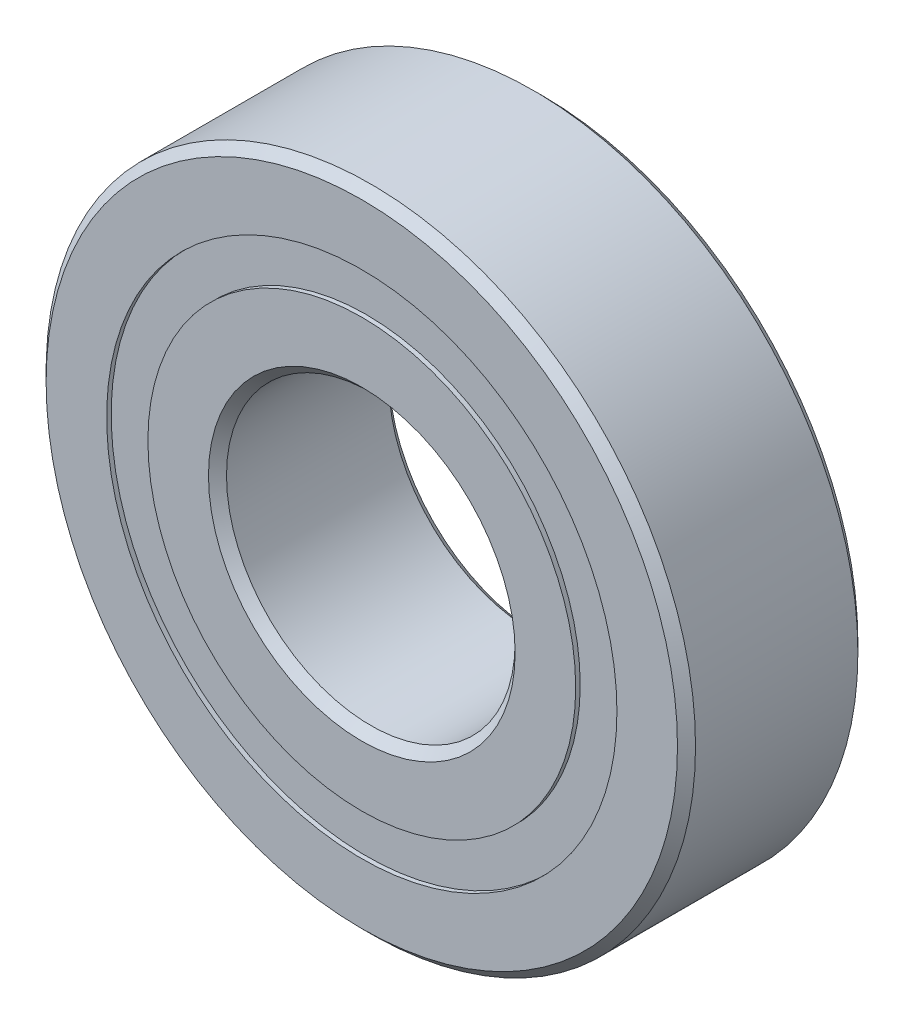
from build123d import *

# Parameters (mm, degrees)
CIRPATTERN1_COUNT = 10
SKETCH5_W         = 1.786827644
SKETCH5_H         = 1.814285714


with BuildPart() as part:
    # Sketch1 → Revolve1 (revolve)
    with BuildSketch(Plane(origin=(0, 0, 0), x_dir=(0, 0, -1), z_dir=(1, 0, 0))):
        with BuildLine():
            Line((3.571875, 14.2875), (-3.571875, 14.2875))
            Line((-3.571875, 14.2875), (-3.96875, 13.890625))
            Line((-3.96875, 13.890625), (-3.96875, 11.225892857))
            Line((-3.96875, 11.225892857), (-1.763888889, 11.225892857))
            ThreePointArc((-1.763888889, 11.225892857), (0, 12.302234856), (1.763888889, 11.225892857))
            Line((1.763888889, 11.225892857), (3.96875, 11.225892857))
            Line((3.96875, 11.225892857), (3.96875, 13.890625))
            Line((3.96875, 13.890625), (3.571875, 14.2875))
        make_face()
    revolve(axis=Axis((0, 0, 3.96875), (0, 0, -1)))


with BuildPart() as body_2:
    # Sketch3 → Revolve3 (revolve)
    with BuildSketch(Plane(origin=(0, 0, 0), x_dir=(0, 0, -1), z_dir=(1, 0, 0))):
        with BuildLine():
            Line((-3.96875, 9.411607143), (-1.763888889, 9.411607143))
            ThreePointArc((-1.763888889, 9.411607143), (0, 8.335265144), (1.763888889, 9.411607143))
            Line((1.763888889, 9.411607143), (3.96875, 9.411607143))
            Line((3.96875, 9.411607143), (3.96875, 6.746875))
            Line((3.96875, 6.746875), (3.571875, 6.35))
            Line((3.571875, 6.35), (-3.571875, 6.35))
            Line((-3.571875, 6.35), (-3.96875, 6.746875))
            Line((-3.96875, 6.746875), (-3.96875, 9.411607143))
        make_face()
    revolve(axis=Axis((0, 0, 3.96875), (0, 0, -1)))


with BuildPart() as body_3:
    # Sketch4 → Revolve4 (revolve)
    with BuildSketch(Plane(origin=(0, 0, 0), x_dir=(0, 0, -1), z_dir=(1, 0, 0))):
        with BuildLine():
            Line((-1.983484856, 10.31875), (1.983484856, 10.31875))
            ThreePointArc((1.983484856, 10.31875), (0, 12.302234856), (-1.983484856, 10.31875))
        make_face()
    revolve(axis=Axis((0, 10.31875, 1.983484856), (0, 0, -1)))


with BuildPart() as cirpattern1_1:
    # CirPattern1: pattern copy
    add(body_3.part.rotate(Axis((0, 0, -3.96875), (0, 0, 1)), 1 * 360 / CIRPATTERN1_COUNT))


with BuildPart() as cirpattern1_2:
    # CirPattern1: pattern copy
    add(body_3.part.rotate(Axis((0, 0, -3.96875), (0, 0, 1)), 2 * 360 / CIRPATTERN1_COUNT))


with BuildPart() as cirpattern1_3:
    # CirPattern1: pattern copy
    add(body_3.part.rotate(Axis((0, 0, -3.96875), (0, 0, 1)), 3 * 360 / CIRPATTERN1_COUNT))


with BuildPart() as cirpattern1_4:
    # CirPattern1: pattern copy
    add(body_3.part.rotate(Axis((0, 0, -3.96875), (0, 0, 1)), 4 * 360 / CIRPATTERN1_COUNT))


with BuildPart() as cirpattern1_5:
    # CirPattern1: pattern copy
    add(body_3.part.rotate(Axis((0, 0, -3.96875), (0, 0, 1)), 5 * 360 / CIRPATTERN1_COUNT))


with BuildPart() as cirpattern1_6:
    # CirPattern1: pattern copy
    add(body_3.part.rotate(Axis((0, 0, -3.96875), (0, 0, 1)), 6 * 360 / CIRPATTERN1_COUNT))


with BuildPart() as cirpattern1_7:
    # CirPattern1: pattern copy
    add(body_3.part.rotate(Axis((0, 0, -3.96875), (0, 0, 1)), 7 * 360 / CIRPATTERN1_COUNT))


with BuildPart() as cirpattern1_8:
    # CirPattern1: pattern copy
    add(body_3.part.rotate(Axis((0, 0, -3.96875), (0, 0, 1)), 8 * 360 / CIRPATTERN1_COUNT))


with BuildPart() as cirpattern1_9:
    # CirPattern1: pattern copy
    add(body_3.part.rotate(Axis((0, 0, -3.96875), (0, 0, 1)), 9 * 360 / CIRPATTERN1_COUNT))


with BuildPart() as body_13:
    # Sketch5 → Revolve5 (revolve)
    with BuildSketch(Plane(origin=(0, 0, 0), x_dir=(0, 0, -1), z_dir=(1, 0, 0))):
        with Locations((-2.876898678, 10.31875)):
            Rectangle(SKETCH5_W, SKETCH5_H)
        with Locations((2.876898678, 10.31875)):
            Rectangle(SKETCH5_W, SKETCH5_H)
    revolve(axis=Axis((0, 0, 3.96875), (0, 0, -1)))


solid = Compound([part.part, body_2.part, body_3.part, cirpattern1_1.part, cirpattern1_2.part, cirpattern1_3.part, cirpattern1_4.part, cirpattern1_5.part, cirpattern1_6.part, cirpattern1_7.part, cirpattern1_8.part, cirpattern1_9.part, body_13.part])
